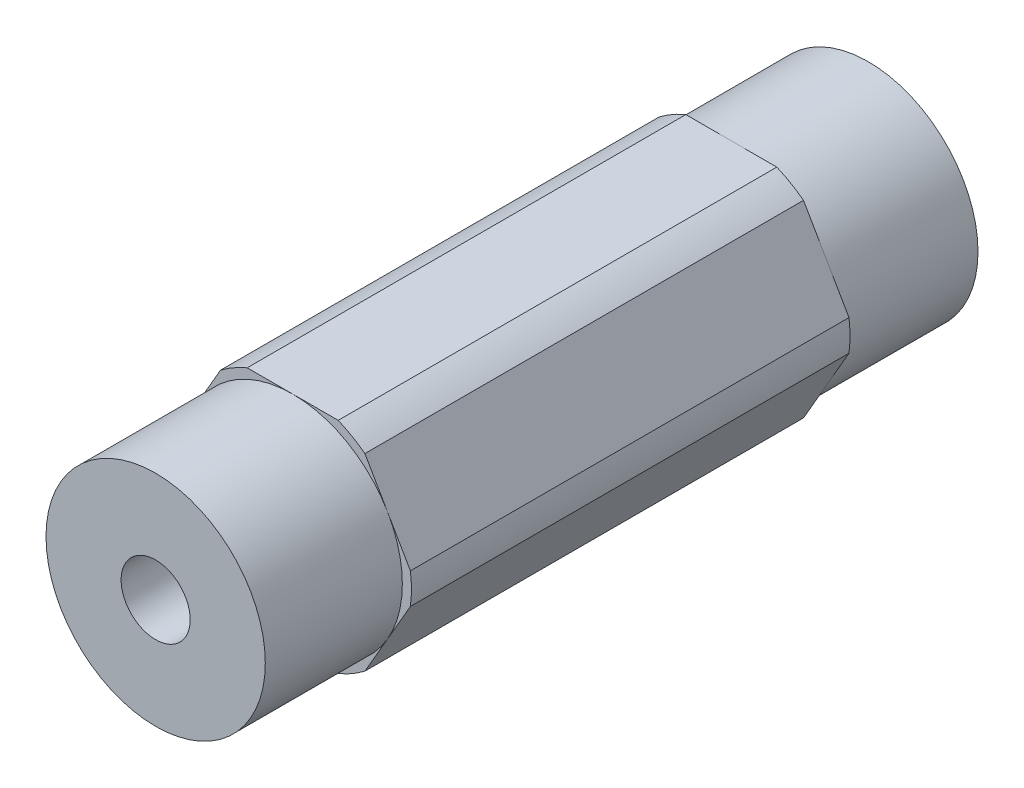
from build123d import *

# Parameters (mm, degrees)
SKETCH1_R           = 2.000000064
BOSS_EXTRUDE1_DEPTH = 12.7
SKETCH4_R           = 6.35
SKETCH4_R_2         = 2.000000064
BOSS_EXTRUDE2_DEPTH = 7.9375


with BuildPart() as part:
    # Sketch1 → Boss-Extrude1 (new, symmetric)
    with BuildSketch(Plane.XY):
        with BuildLine():
            ThreePointArc((4.181770846, 5.456960429), (3.437499983, 5.953924622), (2.634980936, 6.35))
            Line((2.634980936, 6.35), (-2.634980936, 6.35))
            ThreePointArc((-2.634980936, 6.35), (-3.437499983, 5.953924622), (-4.181770846, 5.456960429))
            Line((-4.181770846, 5.456960429), (-6.816751782, 0.893039571))
            ThreePointArc((-6.816751782, 0.893039571), (-6.874999966, 0), (-6.816751782, -0.893039571))
            Line((-6.816751782, -0.893039571), (-4.181770846, -5.456960429))
            ThreePointArc((-4.181770846, -5.456960429), (-3.437499983, -5.953924622), (-2.634980936, -6.35))
            Line((-2.634980936, -6.35), (2.634980936, -6.35))
            ThreePointArc((2.634980936, -6.35), (3.437499983, -5.953924622), (4.181770846, -5.456960429))
            Line((4.181770846, -5.456960429), (6.816751782, -0.893039571))
            ThreePointArc((6.816751782, -0.893039571), (6.860422465, -0.447468582), (6.874999966, 0))
            ThreePointArc((6.874999966, 0), (6.860422465, 0.447468582), (6.816751782, 0.893039571))
            Line((6.816751782, 0.893039571), (4.181770846, 5.456960429))
        make_face()
        Circle(SKETCH1_R, mode=Mode.SUBTRACT)
    extrude(amount=BOSS_EXTRUDE1_DEPTH, both=True)

    # Sketch4 → Boss-Extrude2 (add)
    with BuildSketch(Plane.XY.offset(12.7)):
        with Locations(Location((0, 0, 0), (0, 0, 150))):
            Circle(SKETCH4_R)
        Circle(SKETCH4_R_2, mode=Mode.SUBTRACT)
    boss_extrude2 = extrude(amount=BOSS_EXTRUDE2_DEPTH)

    # Mirror1: Boss-Extrude2 across plane
    add(boss_extrude2.mirror(Plane.XY))


solid = part.part
